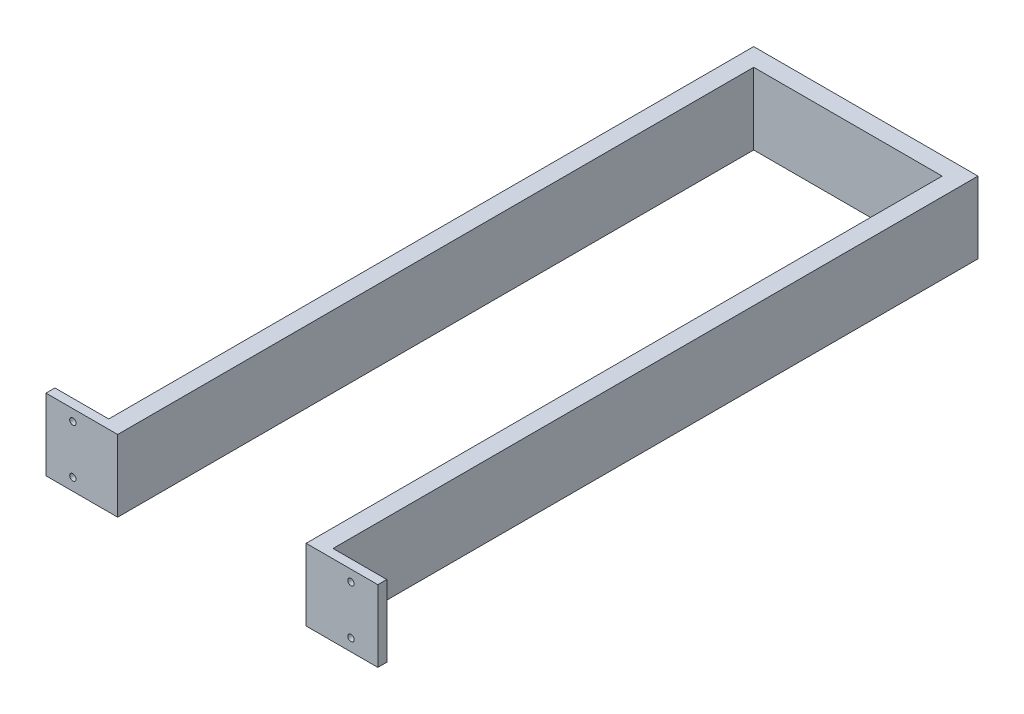
from build123d import *

# Parameters (mm, degrees)
SKETCH1_W             = 25.4
SKETCH1_H             = 25.4
BOSS_EXTRUDE1_DEPTH   = 3.175
SKETCH3_W             = 6.35
SKETCH3_H             = 25.4
BOSS_EXTRUDE2_DEPTH   = 228.6
F_4_40_TAPPED_HOLE1_D = 2.2606
SKETCH7_W             = 6.35
SKETCH7_H             = 25.4
BOSS_EXTRUDE3_DEPTH   = 73.152
SKETCH9_W             = 6.35
SKETCH9_H             = 25.4
BOSS_EXTRUDE4_DEPTH   = 222.25
SKETCH10_W            = 25.4
SKETCH10_H            = 25.4
BOSS_EXTRUDE5_DEPTH   = 3.175
F_4_40_TAPPED_HOLE4_D = 2.2606
BOSS_EXTRUDE6_START   = -3.175
SKETCH16_R            = 1.1303
BOSS_EXTRUDE6_DEPTH   = 3.175


with BuildPart() as part:
    # Sketch1 → Boss-Extrude1 (new body)
    with BuildSketch(Plane.XY):
        Rectangle(SKETCH1_W, SKETCH1_H)
    extrude(amount=BOSS_EXTRUDE1_DEPTH)

    # Sketch3 → Boss-Extrude2 (add)
    with BuildSketch(Plane(origin=(0, 0, 0), x_dir=(-1, 0, 0), z_dir=(0, 0, -1))):
        with Locations((-9.525, 0)):
            Rectangle(SKETCH3_W, SKETCH3_H)
    extrude(amount=BOSS_EXTRUDE2_DEPTH)

    # #4-40 Tapped Hole1 (through all)
    with Locations(Plane(origin=(0, 0, 0), x_dir=(-1, 0, 0), z_dir=(0, 0, -1))):
        with Locations((3.175, 8.746639232), (3.175, -8.393153768)):
            Hole(F_4_40_TAPPED_HOLE1_D / 2)

    # Sketch7 → Boss-Extrude3 (add)
    with BuildSketch(Plane(origin=(12.7, 0, 0), x_dir=(0, 0, -1), z_dir=(1, 0, 0))):
        with Locations((225.425, 0)):
            Rectangle(SKETCH7_W, SKETCH7_H)
    extrude(amount=BOSS_EXTRUDE3_DEPTH)

    # Sketch9 → Boss-Extrude4 (add)
    with BuildSketch(Plane.XY.offset(-222.25)):
        with Locations((82.677, 0)):
            Rectangle(SKETCH9_W, SKETCH9_H)
    extrude(amount=BOSS_EXTRUDE4_DEPTH)

    # Sketch10 → Boss-Extrude5 (add)
    with BuildSketch(Plane.XY):
        with Locations((92.202, 0)):
            Rectangle(SKETCH10_W, SKETCH10_H)
    extrude(amount=BOSS_EXTRUDE5_DEPTH)

    # #4-40 Tapped Hole4 (through all)
    with Locations(Plane.XY.offset(3.175)):
        with Locations((100.484060812, 7.185260309), (95.382, 8.746639232), (95.382, -8.393153768)):
            Hole(F_4_40_TAPPED_HOLE4_D / 2)

    # Sketch16 → Boss-Extrude6 (add)
    with BuildSketch(Plane.XY.offset(3.175).offset(BOSS_EXTRUDE6_START)):
        with Locations((100.484060812, 7.185260309)):
            Circle(SKETCH16_R)
    extrude(amount=BOSS_EXTRUDE6_DEPTH)


solid = part.part
